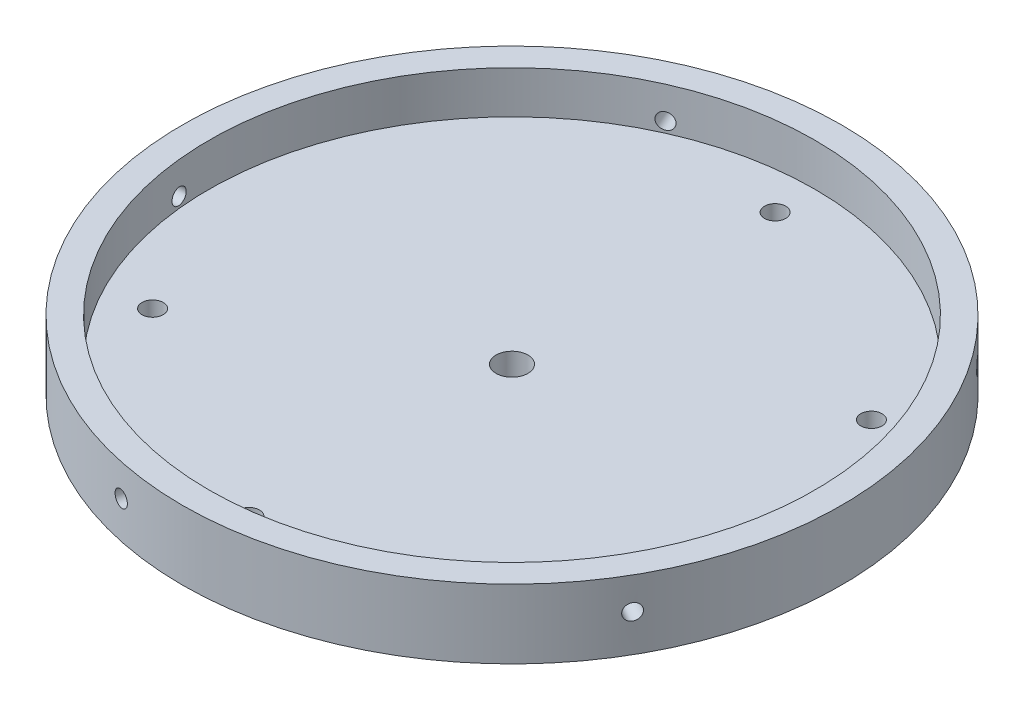
from build123d import *

# Parameters (mm, degrees)
SKETCH1_R               = 62
BOSS_EXTRUDE1_DEPTH     = 5
SKETCH2_R               = 2
CUT_EXTRUDE1_DEPTH      = 5
CIRPATTERN1_COUNT       = 2
CIRPATTERN1_ANGLE       = 120
MIRROR1_COPY_1_SKETCH_R = 2
MIRROR1_COPY_1_DEPTH    = 5
SKETCH5_R               = 62
SKETCH5_R_2             = 57
BOSS_EXTRUDE2_DEPTH     = 8
CUT_EXTRUDE2_START      = -90
SKETCH6_R               = 1.5
CUT_EXTRUDE2_DEPTH      = 91
CIRPATTERN2_COUNT       = 5
SKETCH7_R               = 3
CUT_EXTRUDE3_DEPTH      = 10


with BuildPart() as part:
    # Sketch1 → Boss-Extrude1 (new body)
    with BuildSketch(Plane(origin=(0, 0, 0), x_dir=(1, 0, 0), z_dir=(0, 1, 0))):
        with Locations(Location((0, 0, 0), (0, 0, 270))):
            Circle(SKETCH1_R)
    extrude(amount=BOSS_EXTRUDE1_DEPTH)

    # Sketch2 → Cut-Extrude1 (cut)
    with BuildSketch(Plane(origin=(0, 5, 0), x_dir=(1, 0, 0), z_dir=(0, 1, 0))):
        with Locations(Location((0, 49.5, 0), (0, 0, 270))):
            Circle(SKETCH2_R)
    cut_extrude1 = extrude(amount=-CUT_EXTRUDE1_DEPTH, mode=Mode.SUBTRACT)

    # CirPattern1: Cut-Extrude1 ×2 about axis
    cirpattern1_axis = Axis((0, 5, 0), (0, 1, 0))
    for i in range(1, CIRPATTERN1_COUNT):
        add(cut_extrude1.rotate(cirpattern1_axis, i * CIRPATTERN1_ANGLE / (CIRPATTERN1_COUNT - 1)), mode=Mode.SUBTRACT)

    # Mirror1: Cut-Extrude1 across plane
    add(cut_extrude1.mirror(Plane(origin=(0, 0, 0), x_dir=(-0.49999999999999806, 0, 0.8660254037844398), z_dir=(-0.8660254037844398, 0, -0.49999999999999806))), mode=Mode.SUBTRACT)

    # Mirror1 copy 1 sketch → Mirror1 copy 1 (cut)
    with BuildSketch(Plane(origin=(0, 5, 0), x_dir=(1, 0, 0), z_dir=(0, 1, 0))):
        with Locations((0, -49.5)):
            Circle(MIRROR1_COPY_1_SKETCH_R)
    extrude(amount=-MIRROR1_COPY_1_DEPTH, mode=Mode.SUBTRACT)

    # Sketch5 → Boss-Extrude2 (add)
    with BuildSketch(Plane(origin=(0, 5, 0), x_dir=(1, 0, 0), z_dir=(0, 1, 0))):
        with Locations(Location((0, 0, 0), (0, 0, 270))):
            Circle(SKETCH5_R)
        with Locations(Location((0, 0, 0), (0, 0, 270))):
            Circle(SKETCH5_R_2, mode=Mode.SUBTRACT)
    extrude(amount=BOSS_EXTRUDE2_DEPTH)

    # Sketch6 → Cut-Extrude2 (cut)
    with BuildSketch(Plane(origin=(0, 0, 0), x_dir=(-0.49999999999999806, 0, 0.8660254037844398), z_dir=(-0.8660254037844398, 0, -0.49999999999999806)).offset(CUT_EXTRUDE2_START)):
        with Locations(Location((0, 7, 0), (0, 0, 180))):
            Circle(SKETCH6_R)
    cut_extrude2 = extrude(amount=CUT_EXTRUDE2_DEPTH, mode=Mode.SUBTRACT)

    # CirPattern2: Cut-Extrude2 ×5 about axis
    cirpattern2_axis = Axis((0, 13, 0), (0, 1, 0))
    for i in range(1, CIRPATTERN2_COUNT):
        add(cut_extrude2.rotate(cirpattern2_axis, i * 360 / CIRPATTERN2_COUNT), mode=Mode.SUBTRACT)

    # Sketch7 → Cut-Extrude3 (cut)
    with BuildSketch(Plane(origin=(0, 5, 0), x_dir=(1, 0, 0), z_dir=(0, 1, 0))):
        with Locations(Location((0, 0, 0), (0, 0, 270))):
            Circle(SKETCH7_R)
    extrude(amount=-CUT_EXTRUDE3_DEPTH, mode=Mode.SUBTRACT)


solid = part.part
